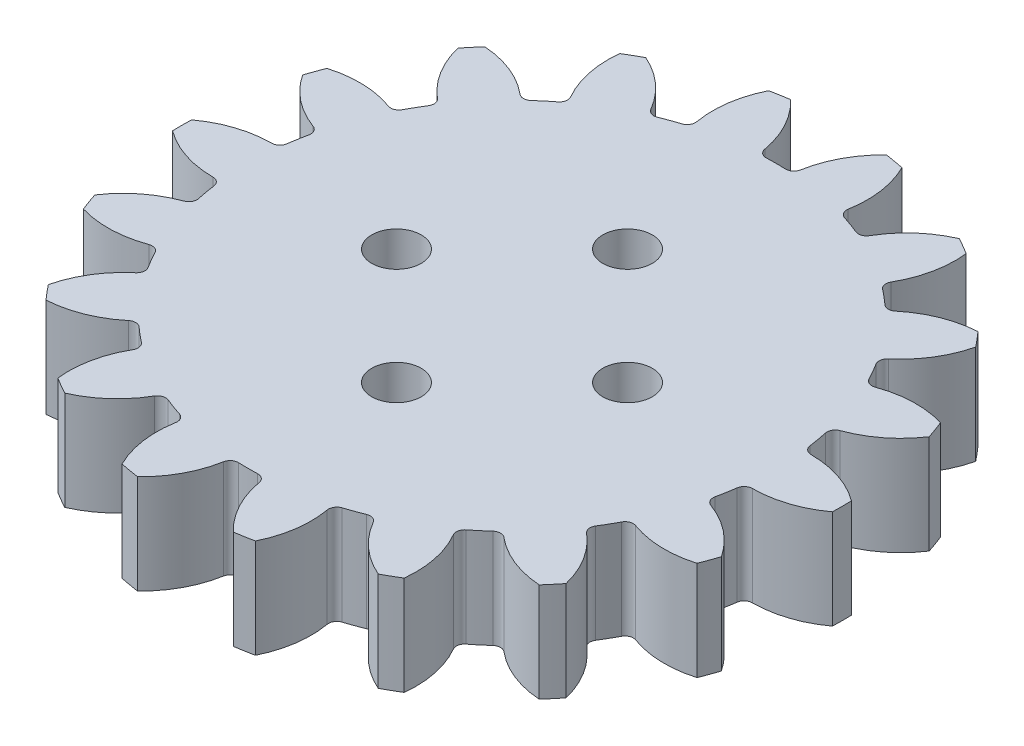
from build123d import *

# Parameters (mm, degrees)
SKETCH_1_R               = 20
SKETCH_1_R_2             = 1.5
EXTRUDE_1_DEPTH          = 6
CUT_EXTRUDE_1_DEPTH      = 29.91366459
PATTERN_CIRCULAR_1_COUNT = 18


with BuildPart() as part:
    # 草图1 → 凸台-拉伸1 (new body)
    with BuildSketch(Plane(origin=(0, 0, 0), x_dir=(1, 0, 0), z_dir=(0, 1, 0))):
        with Locations(Location((0, 0, 0), (0, 0, 270))):
            Circle(SKETCH_1_R)
        with Locations(Location((0, 7, 0), (0, 0, 270))):
            Circle(SKETCH_1_R_2, mode=Mode.SUBTRACT)
        with Locations(Location((7, 0, 0), (0, 0, 270))):
            Circle(SKETCH_1_R_2, mode=Mode.SUBTRACT)
        with Locations(Location((0, -7, 0), (0, 0, 270))):
            Circle(SKETCH_1_R_2, mode=Mode.SUBTRACT)
        with Locations(Location((-7, 0, 0), (0, 0, 270))):
            Circle(SKETCH_1_R_2, mode=Mode.SUBTRACT)
    extrude(amount=EXTRUDE_1_DEPTH)

    # 草图2 → 切除-拉伸1 (cut, symmetric)
    with BuildSketch(Plane(origin=(0, 0, 0), x_dir=(1, 0, 0), z_dir=(0, 1, 0))):
        with BuildLine():
            ThreePointArc((2.90303546, 19.78818802), (0, 20), (-2.90303546, 19.78818802))
            ThreePointArc((-2.90303546, 19.78818802), (-1.72363994, 18.240586555), (-1.086139037, 16.402207735))
            ThreePointArc((-1.086139037, 16.402207735), (-0.908122705, 16.100478627), (-0.57579122, 15.989636158))
            ThreePointArc((-0.57579122, 15.989636158), (0, 16), (0.57579122, 15.989636158))
            ThreePointArc((0.57579122, 15.989636158), (0.908122705, 16.100478627), (1.086139037, 16.402207735))
            ThreePointArc((1.086139037, 16.402207735), (1.72363994, 18.240586555), (2.90303546, 19.78818802))
        make_face()
    cut_extrude_1 = extrude(amount=CUT_EXTRUDE_1_DEPTH, both=True, mode=Mode.SUBTRACT)

    # 阵列(圆周)1: 切除-拉伸1 ×18 about axis
    pattern_circular_1_axis = Axis((0, 0, 0), (0, 1, 0))
    for i in range(1, PATTERN_CIRCULAR_1_COUNT):
        add(cut_extrude_1.rotate(pattern_circular_1_axis, i * 360 / PATTERN_CIRCULAR_1_COUNT), mode=Mode.SUBTRACT)


solid = part.part
